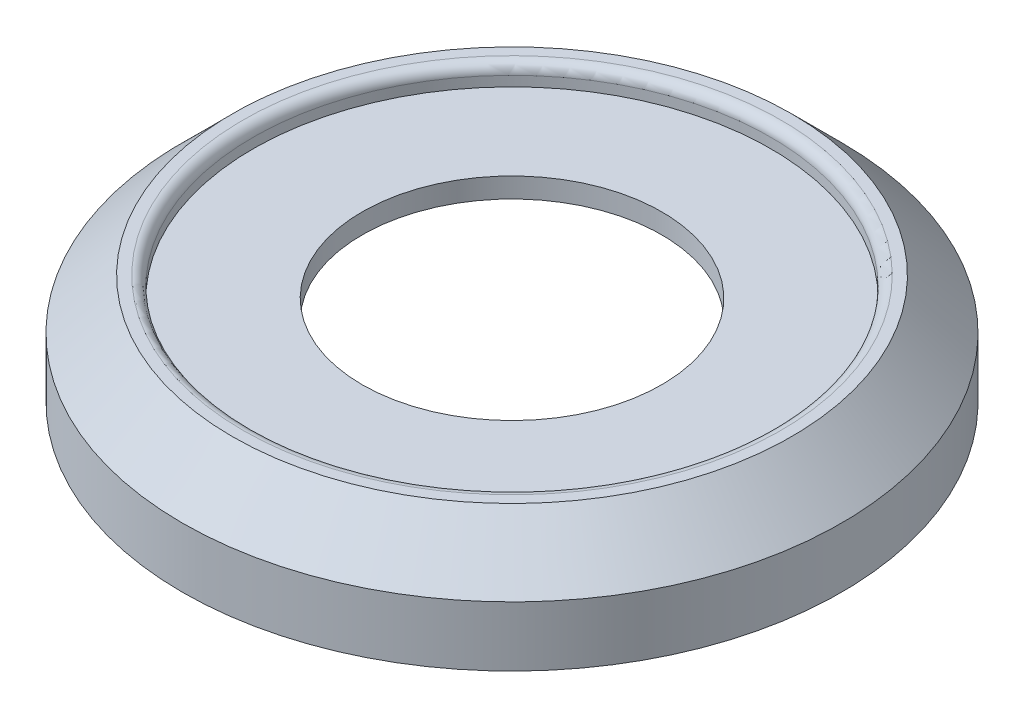
from build123d import *

# Parameters (mm, degrees)
IZIM1_R                     = 33
Y_KSEKLIK_EKSTR_ZYON1_DEPTH = 11
IZIM3_R                     = 31
KES_EKSTR_ZYON1_DEPTH       = 7
IZIM4_R                     = 25.925
KES_EKSTR_ZYON2_DEPTH       = 2
RADYUS2_R                   = 1
PAH1_SIZE                   = 5
IZIM5_R                     = 15
KES_EKSTR_ZYON3_DEPTH       = 2


with BuildPart() as part:
    # Çizim1 → Yükseklik-Ekstrüzyon1 (new body)
    with BuildSketch(Plane(origin=(0, 0, 0), x_dir=(1, 0, 0), z_dir=(0, 1, 0))):
        with Locations(Location((0, 0, 0), (0, 0, 270))):
            Circle(IZIM1_R)
    extrude(amount=Y_KSEKLIK_EKSTR_ZYON1_DEPTH)

    # Çizim3 → Kes-Ekstrüzyon1 (cut)
    with BuildSketch(Plane.XZ):
        with Locations(Location((0, 0, 0), (0, 0, 270))):
            Circle(IZIM3_R)
    extrude(amount=-KES_EKSTR_ZYON1_DEPTH, mode=Mode.SUBTRACT)

    # Çizim4 → Kes-Ekstrüzyon2 (cut)
    with BuildSketch(Plane(origin=(0, 11, 0), x_dir=(1, 0, 0), z_dir=(0, 1, 0))):
        with Locations(Location((0, 0, 0), (0, 0, 270))):
            Circle(IZIM4_R)
    extrude(amount=-KES_EKSTR_ZYON2_DEPTH, mode=Mode.SUBTRACT)

    # Radyus2
    radyus2_edges = [part.edges().sort_by_distance(p)[0] for p in [
        (0, 11, -25.925),
    ]]
    fillet(radyus2_edges, radius=RADYUS2_R)

    # Pah1
    pah1_edges = [part.edges().sort_by_distance(p)[0] for p in [
        (0, 11, -33),
    ]]
    chamfer(pah1_edges, length=PAH1_SIZE)

    # Çizim5 → Kes-Ekstrüzyon3 (cut)
    with BuildSketch(Plane(origin=(0, 9, 0), x_dir=(1, 0, 0), z_dir=(0, 1, 0))):
        with Locations(Location((0, 0, 0), (0, 0, 270))):
            Circle(IZIM5_R)
    extrude(amount=-KES_EKSTR_ZYON3_DEPTH, mode=Mode.SUBTRACT)


solid = part.part
